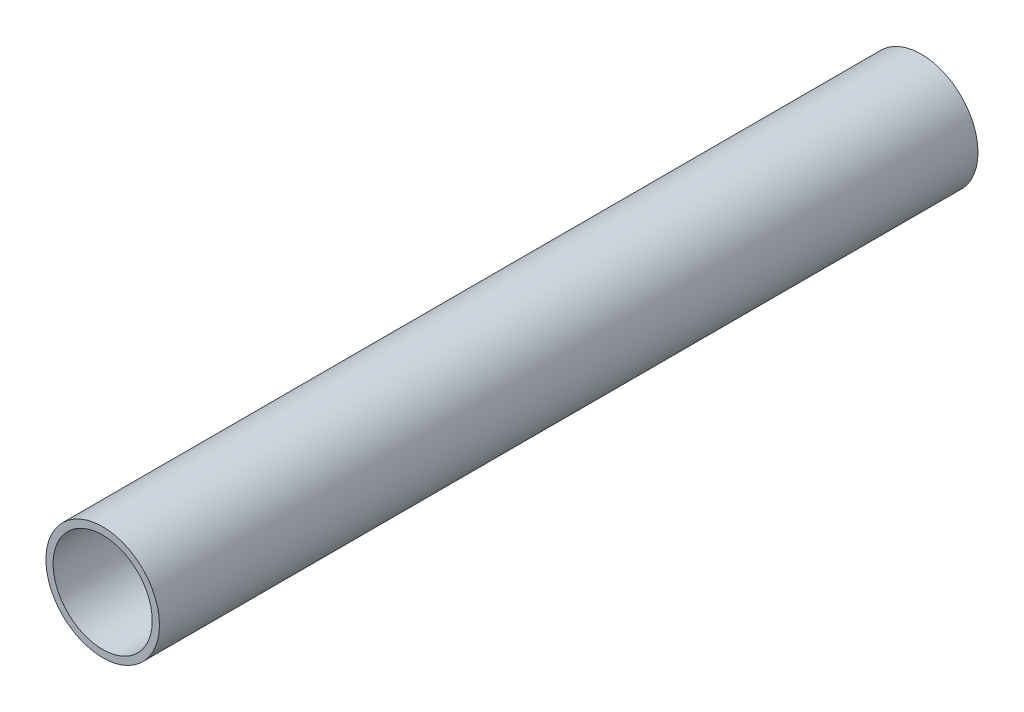
from build123d import *

# Parameters (mm, degrees)
SKETCH1_R           = 9.017
SKETCH1_R_2         = 7.874
BOSS_EXTRUDE1_DEPTH = 130


with BuildPart() as part:
    # Sketch1 → Boss-Extrude1 (new body)
    with BuildSketch(Plane.XY):
        Circle(SKETCH1_R)
        Circle(SKETCH1_R_2, mode=Mode.SUBTRACT)
    extrude(amount=BOSS_EXTRUDE1_DEPTH)


solid = part.part
